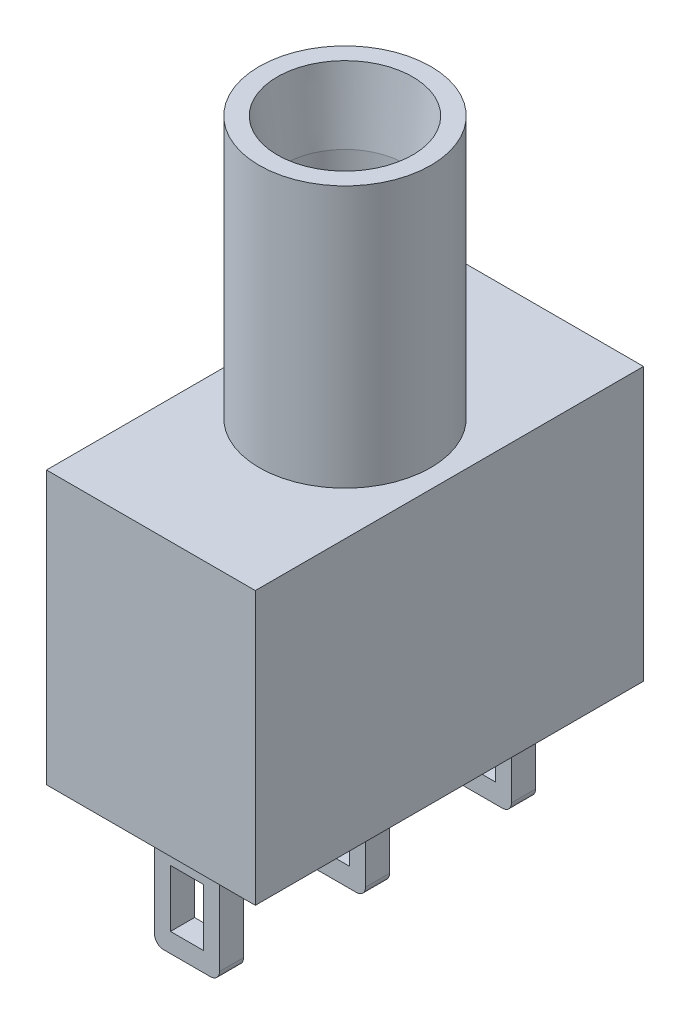
from build123d import *

# Parameters (mm, degrees)
ESQUISSE1_W                  = 6.94
ESQUISSE1_H                  = 12.9
BOSS_EXTRU_1_DEPTH           = 9.06
ESQUISSE2_R                  = 2.85
BOSS_EXTRU_2_DEPTH           = 8.7
ESQUISSE3_R                  = 2
ENL_V_MAT_EXTRU_1_DEPTH      = 8.7
ENL_V_MAT_EXTRU_2_DEPTH      = 2.5
ENL_V_MAT_EXTRU_2_DEPTH_BACK = 2.5
ENL_V_MAT_EXTRU_2_START      = -3.45
ESQUISSE4_R                  = 0.5
CHANFREIN1_SIZE              = 0.25
CHANFREIN1_SIZE2             = 2.378591114
ESQUISSE5_W                  = 2.16
ESQUISSE5_H                  = 0.8
BOSS_EXTRU_3_DEPTH           = 4
CONG_1_R                     = 0.3
ESQUISSE6_W                  = 1.1
ESQUISSE6_H                  = 1.9
ENL_V_MAT_EXTRU_3_DEPTH      = 23.371213646


with BuildPart() as part:
    # Esquisse1 → Boss.-Extru.1 (new body)
    with BuildSketch(Plane(origin=(0, 0, 0), x_dir=(1, 0, 0), z_dir=(0, 1, 0))):
        with Locations((3.47, 6.45)):
            Rectangle(ESQUISSE1_W, ESQUISSE1_H)
    extrude(amount=BOSS_EXTRU_1_DEPTH)

    # Esquisse2 → Boss.-Extru.2 (add)
    with BuildSketch(Plane(origin=(0, 9.06, 0), x_dir=(1, 0, 0), z_dir=(0, 1, 0))):
        with Locations(Location((3.47, 6.45, 0), (0, 0, 90))):
            Circle(ESQUISSE2_R)
    extrude(amount=BOSS_EXTRU_2_DEPTH)

    # Esquisse3 → Enlèv. mat.-Extru.1 (cut)
    with BuildSketch(Plane(origin=(0, 17.76, 0), x_dir=(1, 0, 0), z_dir=(0, 1, 0))):
        with Locations(Location((3.47, 6.45, 0), (0, 0, 270))):
            Circle(ESQUISSE3_R)
    extrude(amount=-ENL_V_MAT_EXTRU_1_DEPTH, mode=Mode.SUBTRACT)

    # Esquisse4 → Enlèv. mat.-Extru.2 (cut, two sides: drawn at the far end of the back side and taken through both)
    with BuildSketch(Plane.ZY.offset(ENL_V_MAT_EXTRU_2_START - ENL_V_MAT_EXTRU_2_DEPTH_BACK)):
        with Locations(Location((-6.453279692, 14.76, 0), (0, 0, 180))):
            Circle(ESQUISSE4_R)
    extrude(amount=ENL_V_MAT_EXTRU_2_DEPTH + ENL_V_MAT_EXTRU_2_DEPTH_BACK, mode=Mode.SUBTRACT)

    # Chanfrein1
    chanfrein1_edges = [part.edges().sort_by_distance(p)[0] for p in [
        (3.47, 17.76, -8.45),
    ]]
    chanfrein1_side = [part.faces().sort_by_distance(p)[0] for p in [
        (3.47, 17.76, -3.680610173),
    ]]
    chamfer(chanfrein1_edges, length=CHANFREIN1_SIZE, length2=CHANFREIN1_SIZE2, reference=chanfrein1_side[0])

    # Esquisse5 → Boss.-Extru.3 (add)
    with BuildSketch(Plane.XZ):
        with Locations((3.47, -1.6)):
            Rectangle(ESQUISSE5_W, ESQUISSE5_H)
        with Locations((3.47, -11.3)):
            Rectangle(ESQUISSE5_W, ESQUISSE5_H)
        with Locations((3.47, -6.45)):
            Rectangle(ESQUISSE5_W, ESQUISSE5_H)
    extrude(amount=BOSS_EXTRU_3_DEPTH)

    # Congé1
    cong_1_edges = [part.edges().sort_by_distance(p)[0] for p in [
        (2.39, -4, -1.6),
        (4.55, -4, -1.6),
        (4.55, -4, -11.3),
        (2.39, -4, -11.3),
        (2.39, -4, -6.45),
        (4.55, -4, -6.45),
    ]]
    fillet(cong_1_edges, radius=CONG_1_R)

    # Esquisse6 → Enlèv. mat.-Extru.3 (cut, through all)
    with BuildSketch(Plane(origin=(0, 0, -11.7), x_dir=(-1, 0, 0), z_dir=(0, 0, -1))):
        with Locations((-3.470290463, -2.41)):
            Rectangle(ESQUISSE6_W, ESQUISSE6_H)
    extrude(amount=-ENL_V_MAT_EXTRU_3_DEPTH, mode=Mode.SUBTRACT)


solid = part.part
